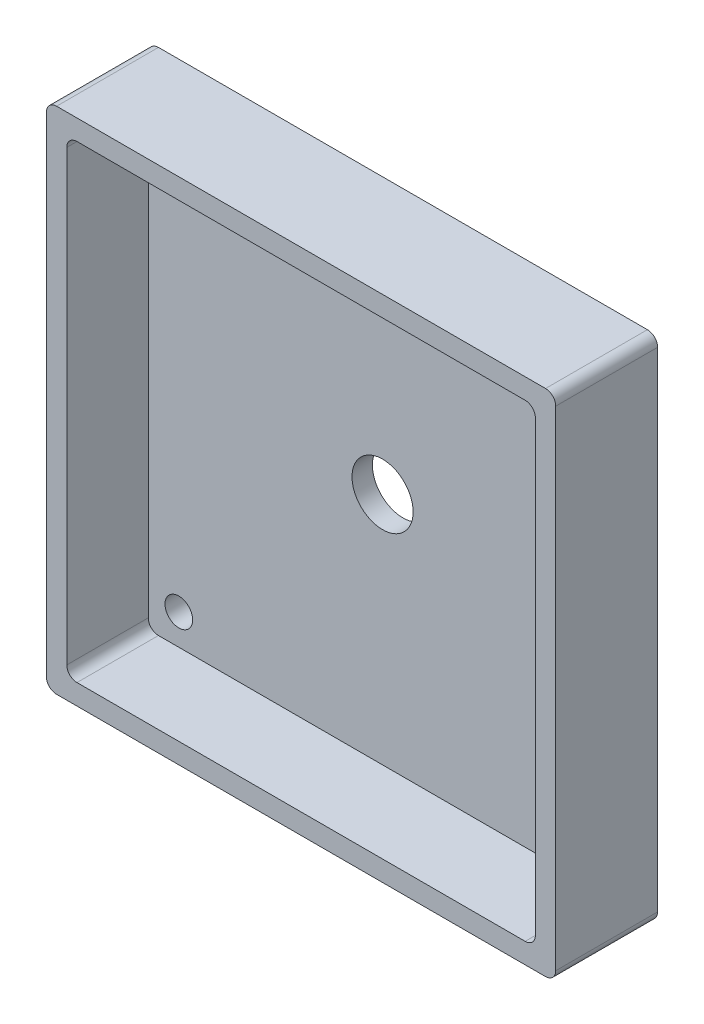
from build123d import *

# Parameters (mm, degrees)
SKETCH1_W           = 100
SKETCH1_H           = 100
BOSS_EXTRUDE1_DEPTH = 20
SKETCH2_W           = 92
SKETCH2_H           = 92
CUT_EXTRUDE1_DEPTH  = 16
FILLET1_R           = 2
SKETCH3_R           = 6
SKETCH3_R_2         = 2.713966801
CUT_EXTRUDE2_DEPTH  = 16


with BuildPart() as part:
    # Sketch1 → Boss-Extrude1 (new body)
    with BuildSketch(Plane.XY):
        Rectangle(SKETCH1_W, SKETCH1_H)
    extrude(amount=BOSS_EXTRUDE1_DEPTH)

    # Sketch2 → Cut-Extrude1 (cut)
    with BuildSketch(Plane.XY.offset(20)):
        Rectangle(SKETCH2_W, SKETCH2_H)
    extrude(amount=-CUT_EXTRUDE1_DEPTH, mode=Mode.SUBTRACT)

    # Fillet1
    fillet1_edges = [part.edges().sort_by_distance(p)[0] for p in [
        (-46, -46, 12),
        (-46, 46, 12),
        (46, 46, 12),
        (46, -46, 12),
        (-50, 50, 10),
        (50, 50, 10),
        (50, -50, 10),
        (-50, -50, 10),
    ]]
    fillet(fillet1_edges, radius=FILLET1_R)

    # Sketch3 → Cut-Extrude2 (cut)
    with BuildSketch(Plane.XY):
        Circle(SKETCH3_R)
        with Locations((-40, 40)):
            Circle(SKETCH3_R_2)
        with Locations((40, 40)):
            Circle(SKETCH3_R_2)
        with Locations((40, -40)):
            Circle(SKETCH3_R_2)
        with Locations((-40, -40)):
            Circle(SKETCH3_R_2)
    extrude(amount=CUT_EXTRUDE2_DEPTH, mode=Mode.SUBTRACT)


solid = part.part
